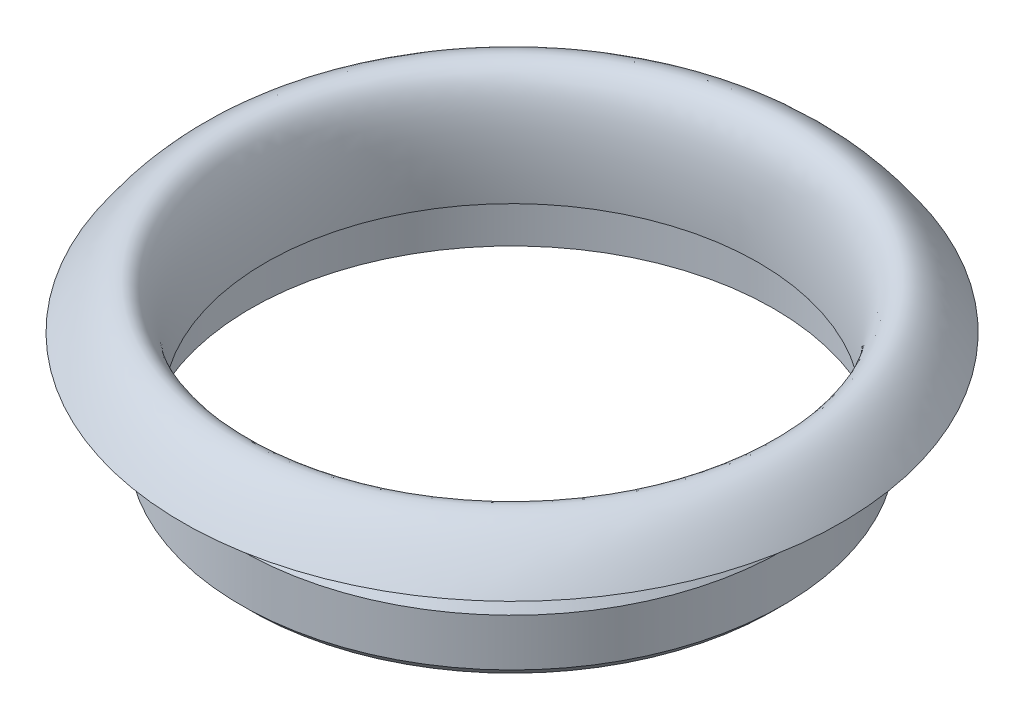
from build123d import *


with BuildPart() as part:
    # Sketch2 → Revolve1 (revolve)
    with BuildSketch(Plane.XY, mode=Mode.PRIVATE) as revolve1_sk:
        with BuildLine():
            add(Edge.make_bspline(
                [(-53.908291981, 7.327266282), (-53.915048613, 7.539366649), (-53.94495988, 8.357050919), (-54.053665037, 10.294944264), (-54.326389869, 12.882424144), (-54.972726359, 16.34709685), (-55.898693692, 18.77001029), (-56.883362954, 20.105486165), (-57.543446966, 20.616490503), (-58.112880499, 20.817571586), (-58.814977092, 20.833320308), (-59.822438492, 20.544156721), (-61.106275976, 19.825684528), (-62.596941056, 18.635703923), (-64.239568543, 16.971141372), (-65.711130001, 15.184476573), (-66.925551876, 13.537321116), (-67.564645811, 12.610199482), (-67.87038563, 12.152912125)],
                knots=[0.106853713, 0.106853713, 0.106853713, 0.106853713, 0.117351765, 0.147787911, 0.208660203, 0.269532495, 0.391277079, 0.452149371, 0.513021663, 0.573893955, 0.634766248, 0.69563854, 0.756510832, 0.817383124, 0.878255416, 0.939127708, 0.969563854, 1, 1, 1, 1], degree=3))
            Line((-67.87038563, 12.152912125), (-69.533005379, 13.264530571))
            add(Edge.make_bspline(
                [(-52, 0), (-50.74543551, 25.338717699), (-58.822132089, 29.284514334), (-69.533005379, 13.264530571)],
                knots=[0, 0, 0, 0, 1, 1, 1, 1], degree=3))
            Line((-52, 0), (-55.2, 0))
            Line((-55.2, 0), (-55.2, -10))
            Line((-55.2, -10), (-57.2, -8))
            Line((-57.2, -8), (-57.2, 0))
            Line((-57.2, 0), (-57.2, 2))
            Line((-57.2, 2), (-53.908291981, 7.327266282))
        make_face()
    revolve(revolve1_sk.sketch.rotate(Axis((0, 0, 0), (0, 1, 0)), 270), axis=Axis((0, 0, 0), (0, 1, 0)))


solid = part.part
